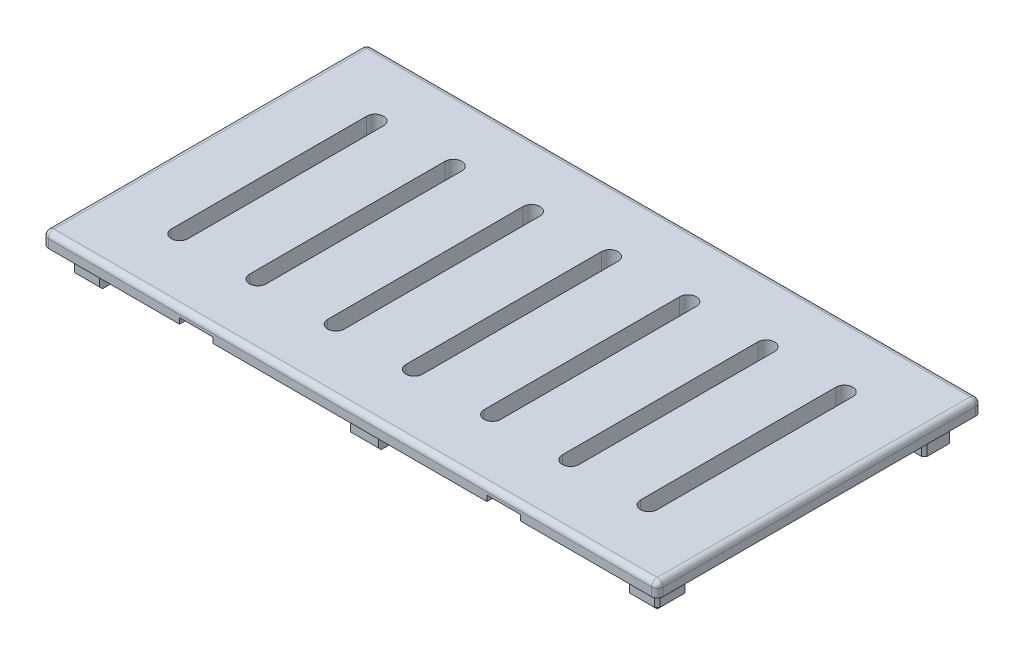
from build123d import *

# Parameters (mm, degrees)
SKETCH1_W           = 110
SKETCH1_H           = 58
BOSS_EXTRUDE1_DEPTH = 2.5
SKETCH2_W           = 104.8
SKETCH2_H           = 52.8
BOSS_EXTRUDE2_DEPTH = 1.5
SKETCH3_W           = 5
SKETCH3_H           = 2
BOSS_EXTRUDE3_DEPTH = 3
FILLET1_R           = 1
SKETCH4_W           = 6
SKETCH4_H           = 2.6
CUT_EXTRUDE1_DEPTH  = 1
FILLET2_R           = 1
CHAMFER1_SIZE       = 0.5
CUT_EXTRUDE2_DEPTH  = 125.551194294
FILLET3_R           = 1


with BuildPart() as part:
    # Sketch1 → Boss-Extrude1 (new body)
    with BuildSketch(Plane(origin=(0, 0, 0), x_dir=(1, 0, 0), z_dir=(0, 1, 0))):
        with Locations((55, 29)):
            Rectangle(SKETCH1_W, SKETCH1_H)
    extrude(amount=BOSS_EXTRUDE1_DEPTH)

    # Sketch2 → Boss-Extrude2 (add)
    with BuildSketch(Plane.XZ):
        with Locations((55, -29)):
            Rectangle(SKETCH2_W, SKETCH2_H)
    extrude(amount=BOSS_EXTRUDE2_DEPTH)

    # Sketch3 → Boss-Extrude3 (add)
    with BuildSketch(Plane.XZ.offset(1.5)):
        with Locations((55, -3.6)):
            Rectangle(SKETCH3_W, SKETCH3_H)
        Polygon((2.6, -2.6), (7.6, -2.6), (7.6, -4.6), (4.6, -4.6), (4.6, -7.6), (2.6, -7.6), align=None)
        Polygon((107.4, -2.6), (107.4, -7.6), (105.4, -7.6), (105.4, -4.6), (102.4, -4.6), (102.4, -2.6), align=None)
        Polygon((107.4, -55.4), (102.4, -55.4), (102.4, -53.4), (105.4, -53.4), (105.4, -50.4), (107.4, -50.4), align=None)
        with Locations((55, -54.4)):
            Rectangle(SKETCH3_W, SKETCH3_H)
        Polygon((2.6, -55.4), (2.6, -50.4), (4.6, -50.4), (4.6, -53.4), (7.6, -53.4), (7.6, -55.4), align=None)
    extrude(amount=BOSS_EXTRUDE3_DEPTH)

    # Fillet1
    fillet1_edges = [part.edges().sort_by_distance(p)[0] for p in [
        (105.4, -3, -53.4),
        (4.6, -3, -4.6),
        (105.4, -3, -4.6),
        (4.6, -3, -53.4),
    ]]
    fillet(fillet1_edges, radius=FILLET1_R)

    # Sketch4 → Cut-Extrude1 (cut)
    with BuildSketch(Plane.XZ):
        with Locations((27.5, -1.3)):
            Rectangle(SKETCH4_W, SKETCH4_H)
        with Locations((82.5, -1.3)):
            Rectangle(SKETCH4_W, SKETCH4_H)
        with Locations((82.5, -56.7)):
            Rectangle(SKETCH4_W, SKETCH4_H)
        with Locations((27.5, -56.7)):
            Rectangle(SKETCH4_W, SKETCH4_H)
    extrude(amount=-CUT_EXTRUDE1_DEPTH, mode=Mode.SUBTRACT)

    # Fillet2
    fillet2_edges = [part.edges().sort_by_distance(p)[0] for p in [
        (0, 1.25, -58),
        (110, 1.25, -58),
        (110, 1.25, 0),
        (0, 1.25, 0),
    ]]
    fillet(fillet2_edges, radius=FILLET2_R)

    # Chamfer1
    chamfer1_edges = [part.edges().sort_by_distance(p)[0] for p in [
        (55, -4.5, -55.4),
        (2.6, -3, -50.4),
        (2.6, -2.25, -55.4),
        (7.6, -3, -55.4),
        (107.4, -3, -50.4),
        (102.4, -3, -55.4),
        (107.4, -2.25, -55.4),
        (107.4, -2.25, -2.6),
        (107.4, -4.5, -5.1),
        (104.9, -4.5, -2.6),
        (55, -4.5, -2.6),
        (2.6, -4.5, -5.1),
        (5.1, -4.5, -2.6),
        (2.6, -2.25, -2.6),
    ]]
    chamfer(chamfer1_edges, length=CHAMFER1_SIZE)

    # Sketch5 → Cut-Extrude2 (cut, through all)
    with BuildSketch(Plane(origin=(0, 2.5, 0), x_dir=(1, 0, 0), z_dir=(0, 1, 0))):
        with BuildLine():
            Line((56.5, 46.5), (56.5, 11.5))
            ThreePointArc((56.5, 11.5), (55, 10), (53.5, 11.5))
            Line((53.5, 11.5), (53.5, 46.5))
            ThreePointArc((53.5, 46.5), (55, 48), (56.5, 46.5))
        make_face()
        with BuildLine():
            Line((67.5, 46.5), (67.5, 11.5))
            ThreePointArc((67.5, 11.5), (69, 10), (70.5, 11.5))
            Line((70.5, 11.5), (70.5, 46.5))
            ThreePointArc((70.5, 46.5), (69, 48), (67.5, 46.5))
        make_face()
        with BuildLine():
            Line((81.5, 46.5), (81.5, 11.5))
            ThreePointArc((81.5, 11.5), (83, 10), (84.5, 11.5))
            Line((84.5, 11.5), (84.5, 46.5))
            ThreePointArc((84.5, 46.5), (83, 48), (81.5, 46.5))
        make_face()
        with BuildLine():
            Line((95.5, 46.5), (95.5, 11.5))
            ThreePointArc((95.5, 11.5), (97, 10), (98.5, 11.5))
            Line((98.5, 11.5), (98.5, 46.5))
            ThreePointArc((98.5, 46.5), (97, 48), (95.5, 46.5))
        make_face()
        with BuildLine():
            Line((39.5, 46.5), (39.5, 11.5))
            ThreePointArc((39.5, 11.5), (41, 10), (42.5, 11.5))
            Line((42.5, 11.5), (42.5, 46.5))
            ThreePointArc((42.5, 46.5), (41, 48), (39.5, 46.5))
        make_face()
        with BuildLine():
            Line((25.5, 46.5), (25.5, 11.5))
            ThreePointArc((25.5, 11.5), (27, 10), (28.5, 11.5))
            Line((28.5, 11.5), (28.5, 46.5))
            ThreePointArc((28.5, 46.5), (27, 48), (25.5, 46.5))
        make_face()
        with BuildLine():
            Line((11.5, 46.5), (11.5, 11.5))
            ThreePointArc((11.5, 11.5), (13, 10), (14.5, 11.5))
            Line((14.5, 11.5), (14.5, 46.5))
            ThreePointArc((14.5, 46.5), (13, 48), (11.5, 46.5))
        make_face()
    extrude(amount=-CUT_EXTRUDE2_DEPTH, mode=Mode.SUBTRACT)

    # Fillet3
    fillet3_edges = [part.edges().sort_by_distance(p)[0] for p in [
        (0, 2.5, -29),
        (55, 2.5, -58),
        (55, 2.5, 0),
        (110, 2.5, -29),
        (109.707106781, 2.5, -0.292893219),
        (109.707106781, 2.5, -57.707106781),
        (0.292893219, 2.5, -0.292893219),
        (0.292893219, 2.5, -57.707106781),
    ]]
    fillet(fillet3_edges, radius=FILLET3_R)


solid = part.part
